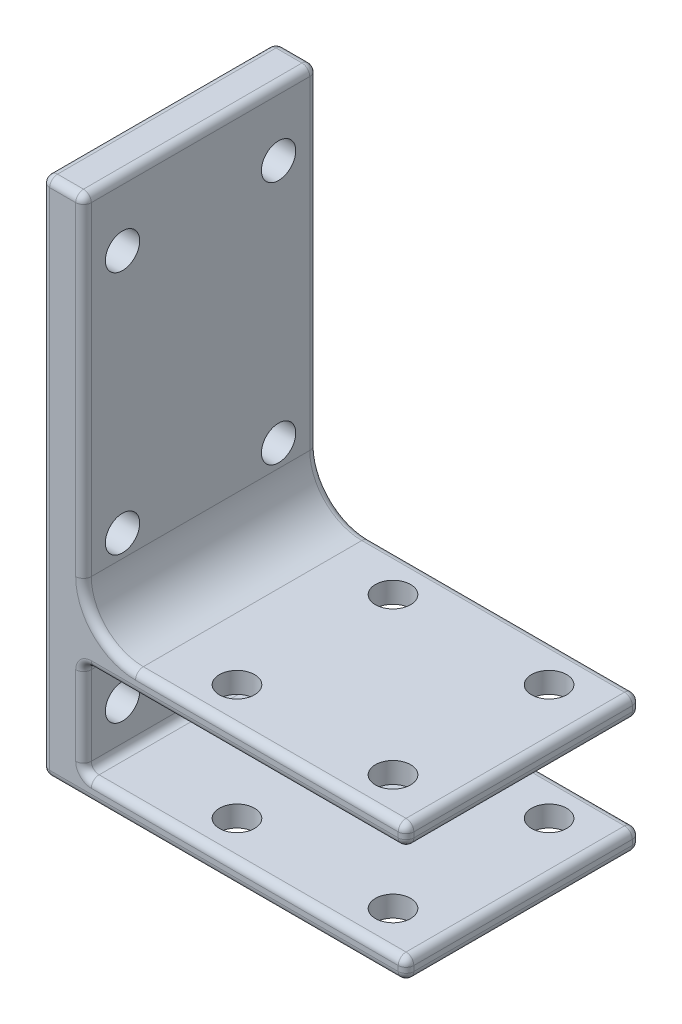
from build123d import *

# Parameters (mm, degrees)
BASE_DEPTH                  = 45
SKETCH2_W                   = 45
SKETCH2_H                   = 4
TOP_SKIN_DEPTH              = 62
SLIDER_BOLT_HOLE_PATTERN_D  = 6.6
DESKTOP_BOLT_HOLE_PATTERN_D = 6.7564
VISIBLE_CORNER_FILLET_R     = 10
BREAK_OTHER_CORNERS_R       = 1.5


with BuildPart() as part:
    # Sketch1 → base (new body)
    with BuildSketch(Plane.XY):
        Polygon((0, 0), (0, 100), (8, 100), (8, 4), (70, 4), (70, 0), align=None)
    extrude(amount=BASE_DEPTH)

    # Sketch2 → top skin (add)
    with BuildSketch(Plane(origin=(8, 0, 0), x_dir=(0, 0, -1), z_dir=(1, 0, 0))):
        with Locations((-22.5, 24.25)):
            Rectangle(SKETCH2_W, SKETCH2_H)
    extrude(amount=TOP_SKIN_DEPTH)

    # slider bolt hole pattern (through all)
    with Locations(Plane(origin=(8, 0, 0), x_dir=(0, 0, -1), z_dir=(1, 0, 0))):
        with Locations((-37.5, 87.5), (-7.5, 12.5), (-37.5, 12.5), (-7.5, 87.5), (-37.5, 40.5), (-7.5, 40.5)):
            Hole(SLIDER_BOLT_HOLE_PATTERN_D / 2)

    # desktop bolt hole pattern (through all)
    with Locations(Plane(origin=(0, 26.25, 0), x_dir=(1, 0, 0), z_dir=(0, 1, 0))):
        with Locations((30, -7.5), (60, -37.5), (30, -37.5), (60, -7.5)):
            Hole(DESKTOP_BOLT_HOLE_PATTERN_D / 2)

    # visible corner fillet
    visible_corner_fillet_edges = [part.edges().sort_by_distance(p)[0] for p in [
        (8, 26.25, 22.5),
    ]]
    fillet(visible_corner_fillet_edges, radius=VISIBLE_CORNER_FILLET_R)

    # break other corners
    break_other_corners_edges = [part.edges().sort_by_distance(p)[0] for p in [
        (39, 4, 45),
        (10.928932188, 29.178932188, 45),
        (10.928932188, 29.178932188, 0),
        (0, 0, 22.5),
        (0, 100, 22.5),
        (8, 100, 22.5),
        (8, 4, 22.5),
        (70, 4, 22.5),
        (70, 0, 22.5),
        (8, 13.125, 45),
        (4, 100, 45),
        (0, 50, 45),
        (70, 26.25, 22.5),
        (44, 26.25, 0),
        (70, 24.25, 0),
        (39, 22.25, 0),
        (70, 22.25, 22.5),
        (39, 22.25, 45),
        (8, 22.25, 22.5),
        (70, 24.25, 45),
        (44, 26.25, 45),
        (35, 0, 45),
        (0, 50, 0),
        (4, 100, 0),
        (8, 13.125, 0),
        (70, 2, 45),
        (39, 4, 0),
        (70, 2, 0),
        (35, 0, 0),
        (8, 68.125, 0),
        (8, 68.125, 45),
    ]]
    fillet(break_other_corners_edges, radius=BREAK_OTHER_CORNERS_R)


solid = part.part
